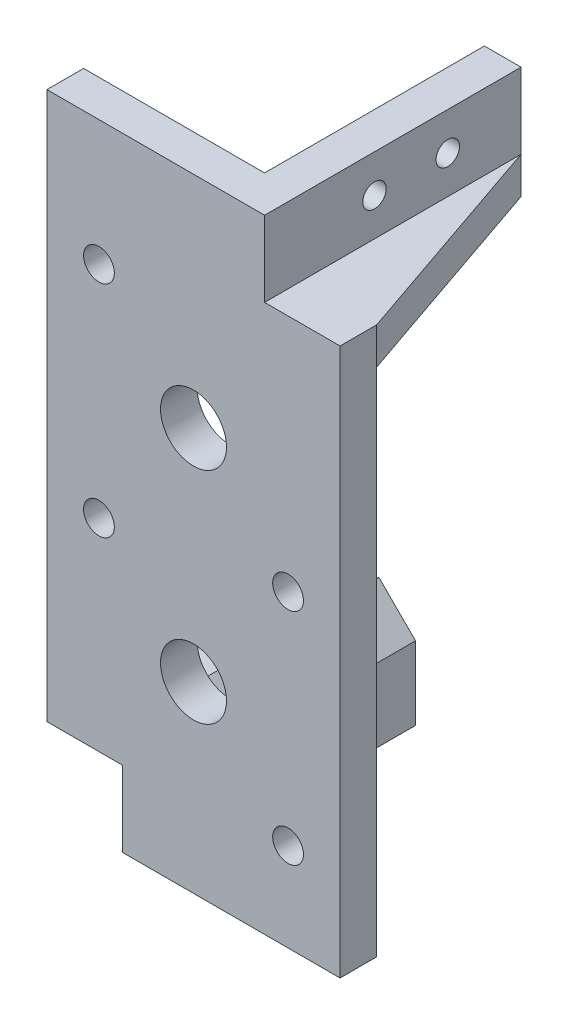
from build123d import *

# Parameters (mm, degrees)
SKETCH1_W           = 80
SKETCH1_H           = 85
BOSS_EXTRUDE1_DEPTH = 5
CUT_EXTRUDE1_REACH  = 60.577
SKETCH2_R           = 4.5
SKETCH2_R_2         = 2.1
CUT_EXTRUDE2_REACH  = 60.577
SKETCH3_W           = 10.3
SKETCH3_H           = 10.3
SKETCH3_W_2         = 10
SKETCH3_H_2         = 10
SKETCH4_W           = 40
SKETCH4_H           = 85
CUT_EXTRUDE4_DEPTH  = 10
SKETCH5_W           = 5
SKETCH5_H           = 10.3
BOSS_EXTRUDE2_DEPTH = 30
BOSS_EXTRUDE3_DEPTH = 5
CUT_EXTRUDE5_REACH  = 67.622
SKETCH7_W           = 10.3
SKETCH7_H           = 10.3
SKETCH8_W           = 5
SKETCH8_H           = 15
BOSS_EXTRUDE4_DEPTH = 30
BOSS_EXTRUDE5_DEPTH = 5
CHAMFER1_SIZE       = 5
CUT_EXTRUDE6_REACH  = 61.903
SKETCH10_R          = 1.6
CUT_EXTRUDE7_REACH  = 61.903
SKETCH12_R          = 1.6


with BuildPart() as part:
    # Sketch1 → Boss-Extrude1 (new body)
    with BuildSketch(Plane.XY):
        Rectangle(SKETCH1_W, SKETCH1_H)
    extrude(amount=BOSS_EXTRUDE1_DEPTH)

    # Sketch2 → Cut-Extrude1 (cut, up to next)
    with BuildSketch(Plane(origin=(0, 0, 0), x_dir=(-1, 0, 0), z_dir=(0, 0, -1)), mode=Mode.PRIVATE) as cut_extrude1_sk1:
        with Locations((-20, 12.5)):
            Circle(SKETCH2_R)
    cut_extrude1_tool1 = extrude(cut_extrude1_sk1.sketch, amount=-CUT_EXTRUDE1_REACH, mode=Mode.PRIVATE) & part.part
    # Sketch2 → Cut-Extrude1 (cut, up to next)
    with BuildSketch(Plane(origin=(0, 0, 0), x_dir=(-1, 0, 0), z_dir=(0, 0, -1)), mode=Mode.PRIVATE) as cut_extrude1_sk2:
        with Locations((-7.095301243, 25.404698757)):
            Circle(SKETCH2_R_2)
    cut_extrude1_tool2 = extrude(cut_extrude1_sk2.sketch, amount=-CUT_EXTRUDE1_REACH, mode=Mode.PRIVATE) & part.part
    # Sketch2 → Cut-Extrude1 (cut, up to next)
    with BuildSketch(Plane(origin=(0, 0, 0), x_dir=(-1, 0, 0), z_dir=(0, 0, -1)), mode=Mode.PRIVATE) as cut_extrude1_sk3:
        with Locations((-32.904698757, -0.404698757)):
            Circle(SKETCH2_R_2)
    cut_extrude1_tool3 = extrude(cut_extrude1_sk3.sketch, amount=-CUT_EXTRUDE1_REACH, mode=Mode.PRIVATE) & part.part
    # Sketch2 → Cut-Extrude1 (cut, up to next)
    with BuildSketch(Plane(origin=(0, 0, 0), x_dir=(-1, 0, 0), z_dir=(0, 0, -1)), mode=Mode.PRIVATE) as cut_extrude1_sk4:
        with Locations((-20, -17.5)):
            Circle(SKETCH2_R)
    cut_extrude1_tool4 = extrude(cut_extrude1_sk4.sketch, amount=-CUT_EXTRUDE1_REACH, mode=Mode.PRIVATE) & part.part
    # Sketch2 → Cut-Extrude1 (cut, up to next)
    with BuildSketch(Plane(origin=(0, 0, 0), x_dir=(-1, 0, 0), z_dir=(0, 0, -1)), mode=Mode.PRIVATE) as cut_extrude1_sk5:
        with Locations((-7.095301243, -4.595301243)):
            Circle(SKETCH2_R_2)
    cut_extrude1_tool5 = extrude(cut_extrude1_sk5.sketch, amount=-CUT_EXTRUDE1_REACH, mode=Mode.PRIVATE) & part.part
    # Sketch2 → Cut-Extrude1 (cut, up to next)
    with BuildSketch(Plane(origin=(0, 0, 0), x_dir=(-1, 0, 0), z_dir=(0, 0, -1)), mode=Mode.PRIVATE) as cut_extrude1_sk6:
        with Locations((-32.904698757, -30.404698757)):
            Circle(SKETCH2_R_2)
    cut_extrude1_tool6 = extrude(cut_extrude1_sk6.sketch, amount=-CUT_EXTRUDE1_REACH, mode=Mode.PRIVATE) & part.part
    add(cut_extrude1_tool1.solids().sort_by_distance((20, 12.5, 0))[0], mode=Mode.SUBTRACT)
    add(cut_extrude1_tool2.solids().sort_by_distance((7.095301, 25.404699, 0))[0], mode=Mode.SUBTRACT)
    add(cut_extrude1_tool3.solids().sort_by_distance((32.904699, -0.404699, 0))[0], mode=Mode.SUBTRACT)
    add(cut_extrude1_tool4.solids().sort_by_distance((20, -17.5, 0))[0], mode=Mode.SUBTRACT)
    add(cut_extrude1_tool5.solids().sort_by_distance((7.095301, -4.595301, 0))[0], mode=Mode.SUBTRACT)
    add(cut_extrude1_tool6.solids().sort_by_distance((32.904699, -30.404699, 0))[0], mode=Mode.SUBTRACT)

    # Sketch3 → Cut-Extrude2 (cut, up to next)
    with BuildSketch(Plane(origin=(0, 0, 0), x_dir=(-1, 0, 0), z_dir=(0, 0, -1)), mode=Mode.PRIVATE) as cut_extrude2_sk1:
        with Locations((-34.85, 37.35)):
            Rectangle(SKETCH3_W, SKETCH3_H)
    cut_extrude2_tool1 = extrude(cut_extrude2_sk1.sketch, amount=-CUT_EXTRUDE2_REACH, mode=Mode.PRIVATE) & part.part
    # Sketch3 → Cut-Extrude2 (cut, up to next)
    with BuildSketch(Plane(origin=(0, 0, 0), x_dir=(-1, 0, 0), z_dir=(0, 0, -1)), mode=Mode.PRIVATE) as cut_extrude2_sk2:
        with Locations((35, 37.5)):
            Rectangle(SKETCH3_W_2, SKETCH3_H_2)
    cut_extrude2_tool2 = extrude(cut_extrude2_sk2.sketch, amount=-CUT_EXTRUDE2_REACH, mode=Mode.PRIVATE) & part.part
    add(cut_extrude2_tool1.solids().sort_by_distance((34.85, 37.35, 0))[0], mode=Mode.SUBTRACT)
    add(cut_extrude2_tool2.solids().sort_by_distance((-35, 37.5, 0))[0], mode=Mode.SUBTRACT)

    # Sketch4 → Cut-Extrude4 (cut)
    with BuildSketch(Plane(origin=(0, 0, 0), x_dir=(-1, 0, 0), z_dir=(0, 0, -1))):
        with Locations((20, 0)):
            Rectangle(SKETCH4_W, SKETCH4_H)
    extrude(amount=-CUT_EXTRUDE4_DEPTH, mode=Mode.SUBTRACT)

    # Sketch5 → Boss-Extrude2 (add)
    with BuildSketch(Plane(origin=(0, 0, 0), x_dir=(-1, 0, 0), z_dir=(0, 0, -1))):
        with Locations((-27.2, 37.35)):
            Rectangle(SKETCH5_W, SKETCH5_H)
    extrude(amount=BOSS_EXTRUDE2_DEPTH)

    # Sketch6 → Boss-Extrude3 (add)
    with BuildSketch(Plane.XZ.offset(-32.2)):
        Polygon((40, 0), (29.7, -30), (24.7, -30), (24.7, 5), (40, 5), align=None)
    extrude(amount=BOSS_EXTRUDE3_DEPTH)

    # Sketch7 → Cut-Extrude5 (cut, up to next)
    with BuildSketch(Plane(origin=(0, 0, 0), x_dir=(-1, 0, 0), z_dir=(0, 0, -1)), mode=Mode.PRIVATE) as cut_extrude5_sk1:
        with Locations((-5.15, -37.35)):
            Rectangle(SKETCH7_W, SKETCH7_H)
    cut_extrude5_tool1 = extrude(cut_extrude5_sk1.sketch, amount=-CUT_EXTRUDE5_REACH, mode=Mode.PRIVATE) & part.part
    add(cut_extrude5_tool1.solids().sort_by_distance((5.15, -37.35, 0))[0], mode=Mode.SUBTRACT)

    # Sketch8 → Boss-Extrude4 (add)
    with BuildSketch(Plane(origin=(0, 0, 0), x_dir=(-1, 0, 0), z_dir=(0, 0, -1))):
        with Locations((-12.8, -35)):
            Rectangle(SKETCH8_W, SKETCH8_H)
    extrude(amount=BOSS_EXTRUDE4_DEPTH)

    # Sketch9 → Boss-Extrude5 (add)
    with BuildSketch(Plane(origin=(0, -27.5, 0), x_dir=(1, 0, 0), z_dir=(0, 1, 0))):
        Polygon((10.3, 30), (0, 0), (10.3, 0), align=None)
    extrude(amount=-BOSS_EXTRUDE5_DEPTH)

    # Chamfer1
    chamfer1_edges = [part.edges().sort_by_distance(p)[0] for p in [
        (15.3, -27.5, -15),
    ]]
    chamfer(chamfer1_edges, length=CHAMFER1_SIZE)

    # Sketch10 → Cut-Extrude6 (cut, up to next)
    with BuildSketch(Plane.ZY.offset(-10.3), mode=Mode.PRIVATE) as cut_extrude6_sk1:
        with Locations((-20, -37.457142857)):
            Circle(SKETCH10_R)
    cut_extrude6_tool1 = extrude(cut_extrude6_sk1.sketch, amount=-CUT_EXTRUDE6_REACH, mode=Mode.PRIVATE) & part.part
    # Sketch10 → Cut-Extrude6 (cut, up to next)
    with BuildSketch(Plane.ZY.offset(-10.3), mode=Mode.PRIVATE) as cut_extrude6_sk2:
        with Locations((-10, -37.414285714)):
            Circle(SKETCH10_R)
    cut_extrude6_tool2 = extrude(cut_extrude6_sk2.sketch, amount=-CUT_EXTRUDE6_REACH, mode=Mode.PRIVATE) & part.part
    add(cut_extrude6_tool1.solids().sort_by_distance((10.3, -37.457143, -20))[0], mode=Mode.SUBTRACT)
    add(cut_extrude6_tool2.solids().sort_by_distance((10.3, -37.414286, -10))[0], mode=Mode.SUBTRACT)

    # Sketch12 → Cut-Extrude7 (cut, up to next)
    with BuildSketch(Plane(origin=(29.7, 0, 0), x_dir=(0, 0, -1), z_dir=(1, 0, 0)), mode=Mode.PRIVATE) as cut_extrude7_sk1:
        with Locations(Location((20, 37.35, 0), (0, 0, 90))):
            Circle(SKETCH12_R)
    cut_extrude7_tool1 = extrude(cut_extrude7_sk1.sketch, amount=-CUT_EXTRUDE7_REACH, mode=Mode.PRIVATE) & part.part
    # Sketch12 → Cut-Extrude7 (cut, up to next)
    with BuildSketch(Plane(origin=(29.7, 0, 0), x_dir=(0, 0, -1), z_dir=(1, 0, 0)), mode=Mode.PRIVATE) as cut_extrude7_sk2:
        with Locations(Location((10, 37.35, 0), (0, 0, 90))):
            Circle(SKETCH12_R)
    cut_extrude7_tool2 = extrude(cut_extrude7_sk2.sketch, amount=-CUT_EXTRUDE7_REACH, mode=Mode.PRIVATE) & part.part
    add(cut_extrude7_tool1.solids().sort_by_distance((29.7, 37.35, -20))[0], mode=Mode.SUBTRACT)
    add(cut_extrude7_tool2.solids().sort_by_distance((29.7, 37.35, -10))[0], mode=Mode.SUBTRACT)


solid = part.part
